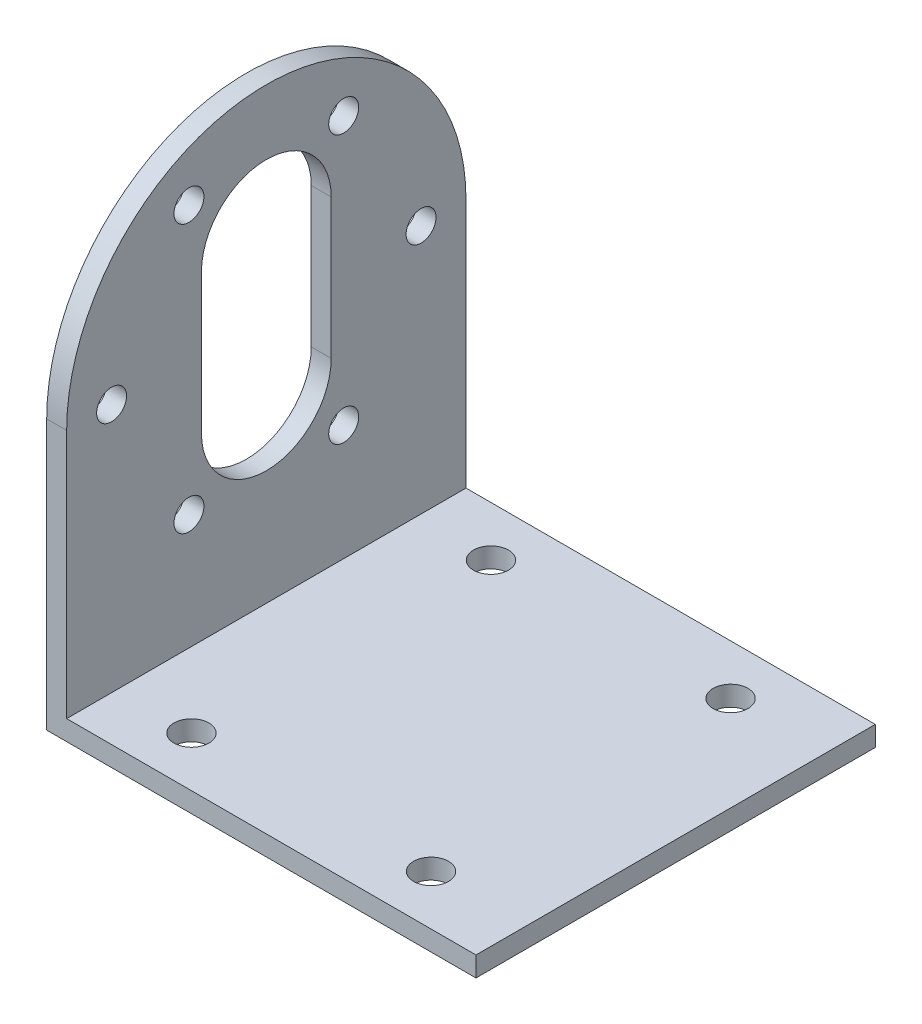
from build123d import *

# Parameters (mm, degrees)
SKETCH_1_R      = 1.5
EXTRUDE_1_DEPTH = 2
SKETCH_3_W      = 43
SKETCH_3_H      = 40
SKETCH_3_R      = 1.75
EXTRUDE_2_DEPTH = 2


with BuildPart() as part:
    # 草图1 → 凸台-拉伸1 (new body)
    with BuildSketch(Plane(origin=(0, 0, 0), x_dir=(0, 0, -1), z_dir=(1, 0, 0))):
        with BuildLine():
            Line((-20, 0), (-20, -27))
            Line((-20, -27), (20, -27))
            Line((20, -27), (20, 0))
            ThreePointArc((20, 0), (0, 20), (-20, 0))
        make_face()
        with Locations((-15.5, 0)):
            Circle(SKETCH_1_R, mode=Mode.SUBTRACT)
        with Locations((-7.75, 13.423393759)):
            Circle(SKETCH_1_R, mode=Mode.SUBTRACT)
        with Locations((7.75, 13.423393759)):
            Circle(SKETCH_1_R, mode=Mode.SUBTRACT)
        with Locations((15.5, 0)):
            Circle(SKETCH_1_R, mode=Mode.SUBTRACT)
        with Locations((7.75, -13.423393759)):
            Circle(SKETCH_1_R, mode=Mode.SUBTRACT)
        with Locations((-7.75, -13.423393759)):
            Circle(SKETCH_1_R, mode=Mode.SUBTRACT)
        with BuildLine():
            Line((6.5, 7), (6.5, -7))
            ThreePointArc((6.5, -7), (0, -13.5), (-6.5, -7))
            Line((-6.5, -7), (-6.5, 7))
            ThreePointArc((-6.5, 7), (0, 13.5), (6.5, 7))
        make_face(mode=Mode.SUBTRACT)
    extrude(amount=EXTRUDE_1_DEPTH)

    # 草图3 → 凸台-拉伸2 (add)
    with BuildSketch(Plane.XZ.offset(27)):
        with Locations((21.5, 0)):
            Rectangle(SKETCH_3_W, SKETCH_3_H)
        with Locations(Location((9.5, 15, 0), (0, 0, 270))):
            Circle(SKETCH_3_R, mode=Mode.SUBTRACT)
        with Locations(Location((9.5, -15, 0), (0, 0, 270))):
            Circle(SKETCH_3_R, mode=Mode.SUBTRACT)
        with Locations(Location((33.5, 15, 0), (0, 0, 270))):
            Circle(SKETCH_3_R, mode=Mode.SUBTRACT)
        with Locations(Location((33.5, -15, 0), (0, 0, 270))):
            Circle(SKETCH_3_R, mode=Mode.SUBTRACT)
    extrude(amount=-EXTRUDE_2_DEPTH)


solid = part.part
